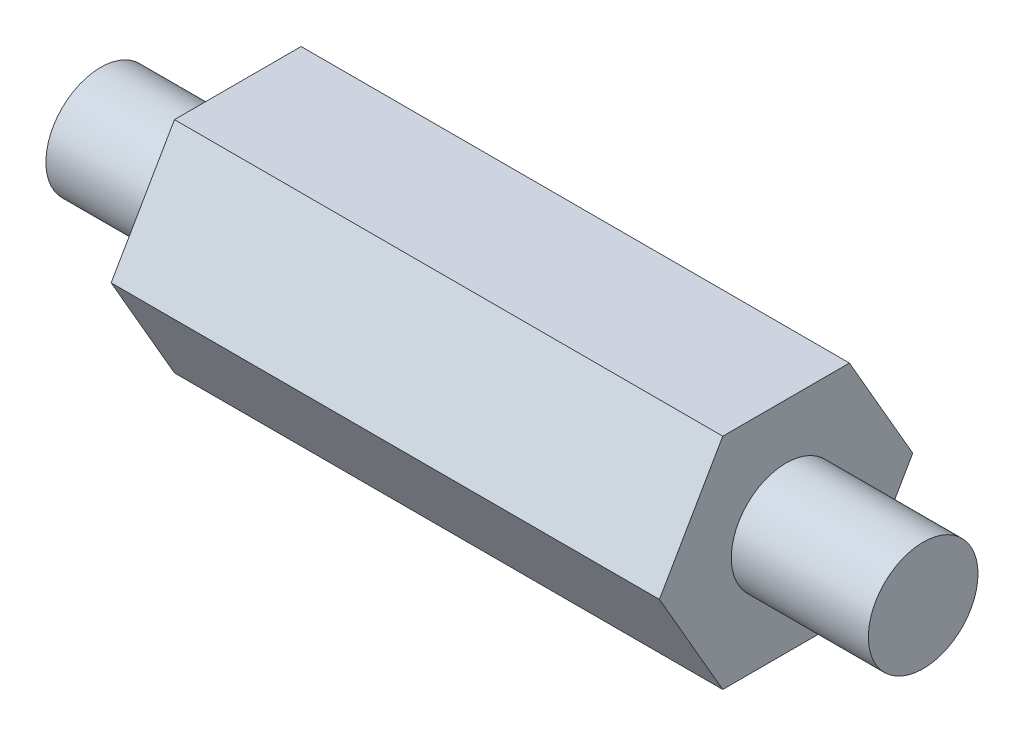
from build123d import *

# Parameters (mm, degrees)
ESQUISSE1_R        = 2
BOSS_EXTRU_1_DEPTH = 15
ESQUISSE1_4_R      = 2
BOSS_EXTRU_2_DEPTH = 10


with BuildPart() as part:
    # Esquisse1 → Boss.-Extru.1 (new, symmetric)
    with BuildSketch(Plane(origin=(0, 0, 0), x_dir=(0, 0, -1), z_dir=(1, 0, 0))):
        Circle(ESQUISSE1_R)
    extrude(amount=BOSS_EXTRU_1_DEPTH, both=True)

    # Esquisse1<4> → Boss.-Extru.2 (add, symmetric)
    with BuildSketch(Plane(origin=(0, 0, 0), x_dir=(0, 0, -1), z_dir=(1, 0, 0))):
        Polygon((2.31, 4.001037365), (-2.31, 4.001037365), (-4.62, 0), (-2.31, -4.001037365), (2.31, -4.001037365), (4.62, 0), align=None)
        Circle(ESQUISSE1_4_R, mode=Mode.SUBTRACT)
    extrude(amount=BOSS_EXTRU_2_DEPTH, both=True)


solid = part.part
